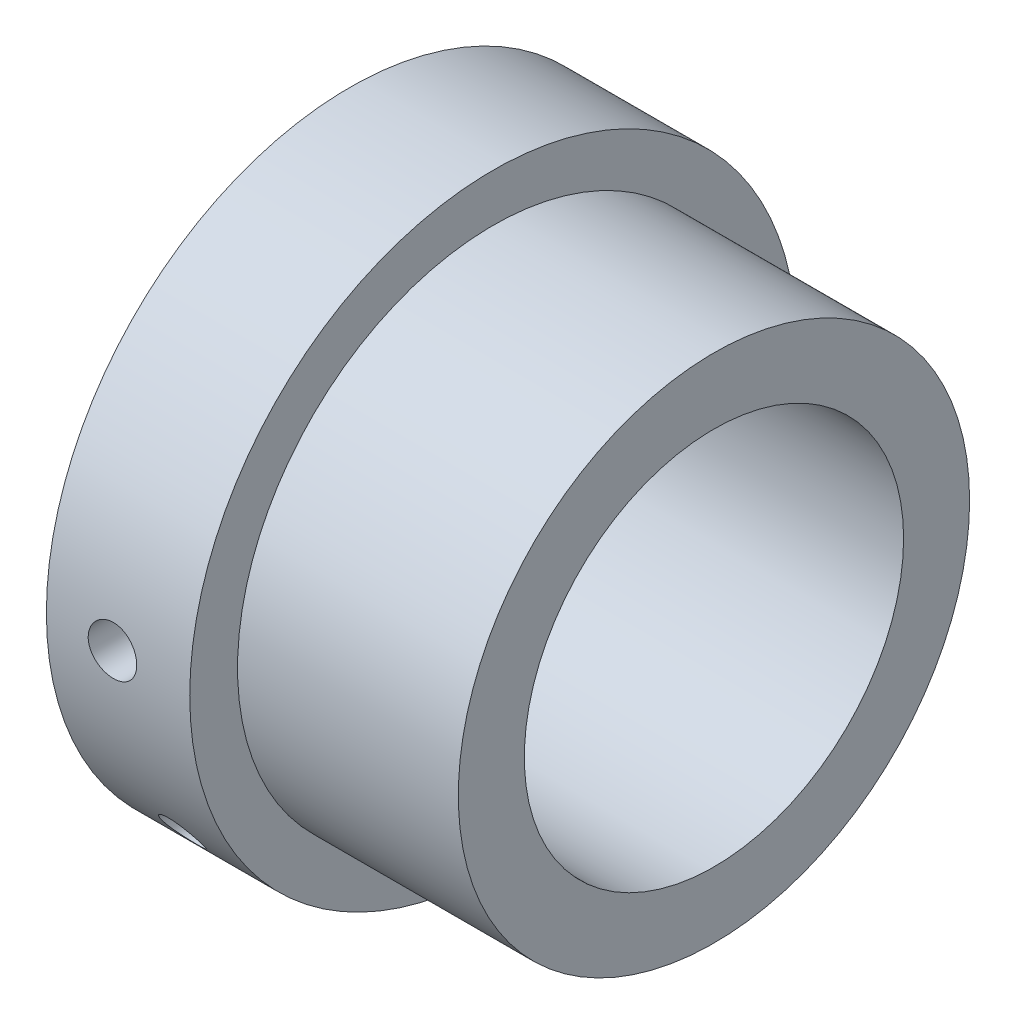
from build123d import *

# Parameters (mm, degrees)
SKETCH1_R           = 6.35
SKETCH1_R_2         = 3.96875
BOSS_EXTRUDE1_DEPTH = 7.62
SKETCH2_W           = 4.62
SKETCH2_H           = 1


with BuildPart() as part:
    # Sketch1 → Boss-Extrude1 (new body)
    with BuildSketch(Plane(origin=(0, 0, 0), x_dir=(0, 0, -1), z_dir=(1, 0, 0))):
        with Locations(Location((0, 0, 0), (0, 0, 180))):
            Circle(SKETCH1_R)
        with Locations(Location((0, 0, 0), (0, 0, 180))):
            Circle(SKETCH1_R_2, mode=Mode.SUBTRACT)
    extrude(amount=BOSS_EXTRUDE1_DEPTH)

    # Sketch2 → Cut-Revolve1 (revolve, cut)
    with BuildSketch(Plane.XY, mode=Mode.PRIVATE) as cut_revolve1_sk:
        with Locations((5.31, 5.85)):
            Rectangle(SKETCH2_W, SKETCH2_H)
    revolve(cut_revolve1_sk.sketch.rotate(Axis((7.62, 0, 0), (-1, 0, 0)), 270), axis=Axis((7.62, 0, 0), (-1, 0, 0)), mode=Mode.SUBTRACT)

    # Sketch3 → #60 (0.04) Diameter Hole1 (revolve, cut)
    with BuildSketch(Plane.YZ.offset(1.382942836)):
        Polygon((0, 0), (0, 25.705237194), (0.508, 25.4), (0.508, 0), align=None)
    revolve(axis=Axis((1.382942836, 0, -6.35), (0, 0, 1)), mode=Mode.SUBTRACT)

    # Sketch5 → 1/32 (0.03125) Diameter Hole1 (revolve, cut)
    with BuildSketch(Plane(origin=(1.524, -3.865933193, -5.08), x_dir=(0, 1, 0), z_dir=(1, 0, 0))):
        Polygon((0, 0), (0, 70.342466558), (0.396875, 70.104), (0.396875, 0), align=None)
    revolve(axis=Axis((1.524, -3.865933193, -11.43), (0, 0, 1)), mode=Mode.SUBTRACT)


solid = part.part
